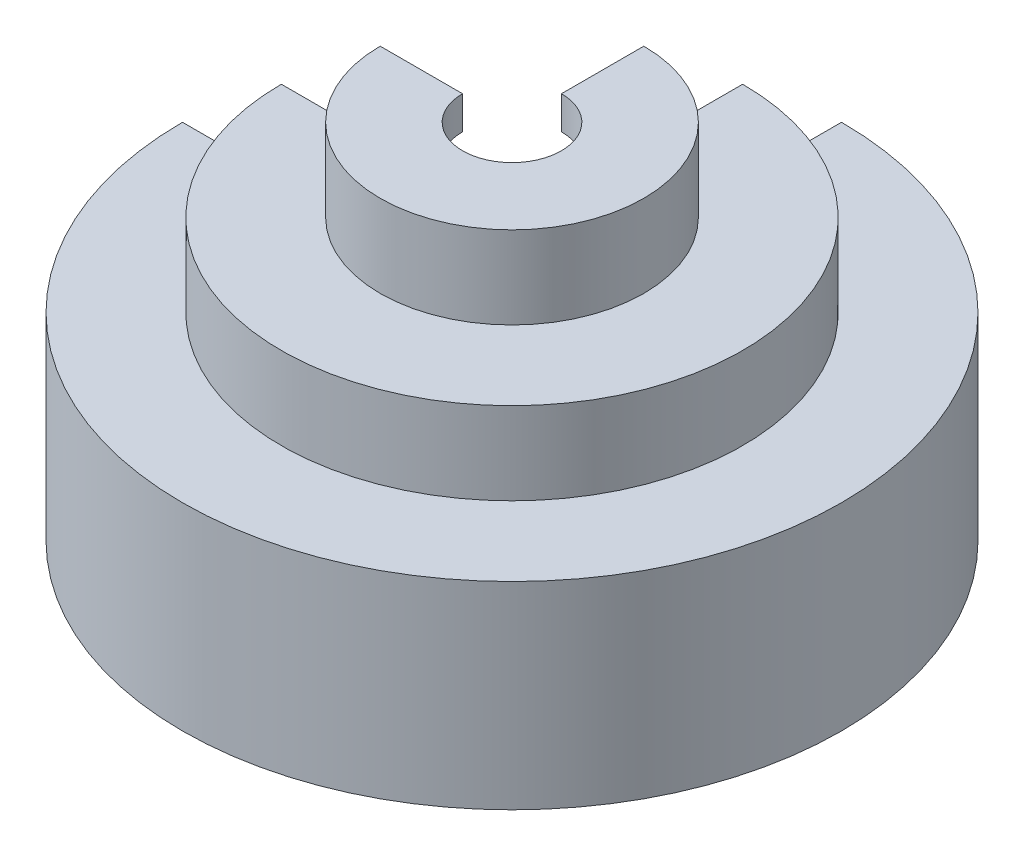
from build123d import *

# Parameters (mm, degrees)
SKETCH2_W          = 278.036516336
SKETCH2_H          = 207.466179174
CUT_EXTRUDE1_DEPTH = 413.310562562


with BuildPart() as part:
    # Sketch1 → Revolve1 (revolve)
    with BuildSketch(Plane.XY, mode=Mode.PRIVATE) as revolve1_sk:
        Polygon((-30, 150), (-80, 150), (-80, 100), (-140, 100), (-140, 50), (-200, 50), (-200, -70), (-80, -70), (-80, -150), (-40, -150), (-40, -30), (-140, -30), (-140, 30), (-80, 30), (-80, 80), (-50, 80), (-50, 130), (-30, 130), align=None)
    revolve(revolve1_sk.sketch.rotate(Axis((0, -150, 0), (0, 1, 0)), 270), axis=Axis((0, -150, 0), (0, 1, 0)))

    # Sketch2 → Cut-Extrude1 (cut, through all)
    with BuildSketch(Plane(origin=(0, 150, 0), x_dir=(1, 0, 0), z_dir=(0, 1, 0))):
        with Locations((-139.018258168, 103.733089587)):
            Rectangle(SKETCH2_W, SKETCH2_H)
    extrude(amount=-CUT_EXTRUDE1_DEPTH, mode=Mode.SUBTRACT)


solid = part.part
